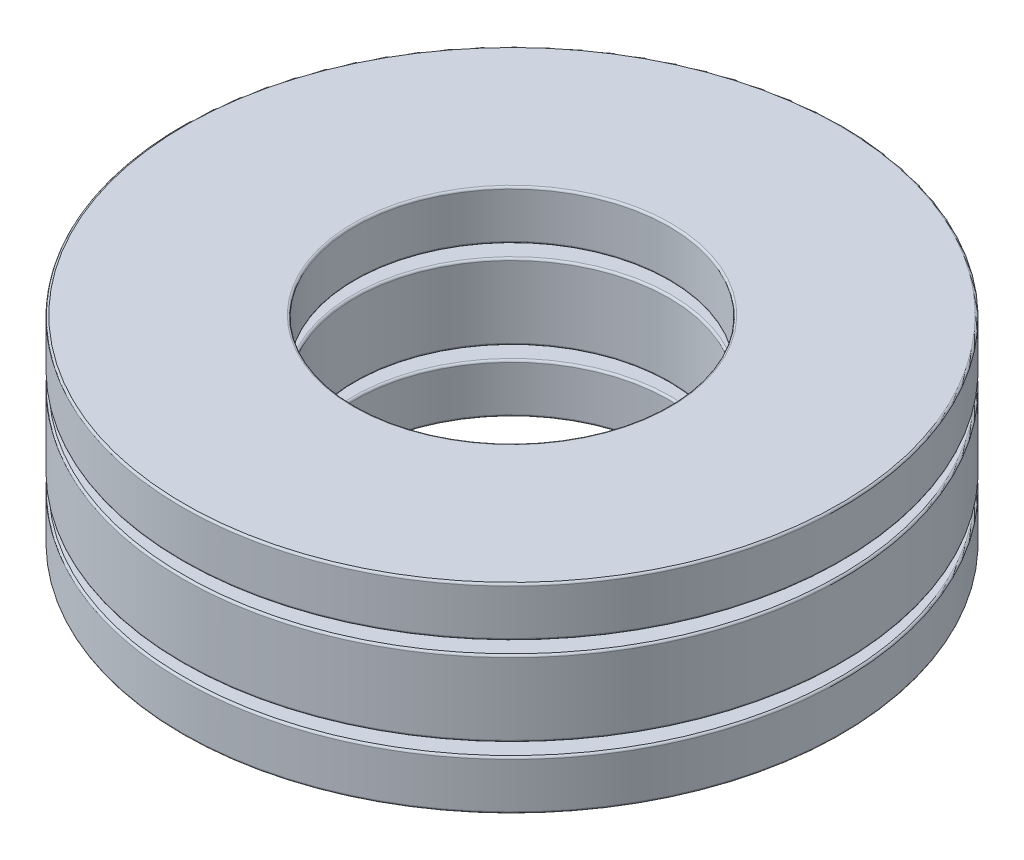
from build123d import *

# Parameters (mm, degrees)
SKETCH3_W         = 5.5
SKETCH3_H         = 2.4075
CIRPATTERN1_COUNT = 6
CIRPATTERN1_ANGLE = 300
CIRPATTERN2_COUNT = 6
SKETCH6_W         = 5.5
SKETCH6_H         = 1.57
FILLET1_R         = 0.0635
FILLET2_R         = 0.0635
FILLET3_R         = 0.0635


with BuildPart() as part:
    # Sketch3 → Revolve1 (revolve)
    with BuildSketch(Plane.XY, mode=Mode.PRIVATE) as revolve1_sk:
        with Locations((7.75, 0)):
            Rectangle(SKETCH3_W, SKETCH3_H)
    revolve(revolve1_sk.sketch.rotate(Axis((0, 3.175, 0), (0, -1, 0)), 90), axis=Axis((0, 3.175, 0), (0, -1, 0)))

    # Sketch4 → Cut-Revolve1 (revolve, cut)
    with BuildSketch(Plane.XY):
        with BuildLine():
            Line((7.55, 1.605), (7.55, -1.605))
            ThreePointArc((7.55, -1.605), (5.945, 0), (7.55, 1.605))
        make_face()
    cut_revolve1 = revolve(axis=Axis((7.55, 1.605, 0), (0, -1, 0)), mode=Mode.SUBTRACT)

    # CirPattern2: Cut-Revolve1 ×6 about axis
    cirpattern2_axis = Axis((0, 0, 0), (0, 1, 0))
    for i in range(1, CIRPATTERN2_COUNT):
        add(cut_revolve1.rotate(cirpattern2_axis, i * 360 / CIRPATTERN2_COUNT), mode=Mode.SUBTRACT)

    # Fillet2
    fillet2_edges = [part.edges().sort_by_distance(p)[0] for p in [
        (8.611607714, 1.20375, 0),
        (8.611607714, -1.20375, 0),
        (4.305803857, 1.20375, 7.457871047),
        (4.305803857, -1.20375, 7.457871047),
        (-4.305803857, 1.20375, 7.457871047),
        (-4.305803857, -1.20375, 7.457871047),
        (-8.611607714, 1.20375, 0),
        (-8.611607714, -1.20375, 0),
        (-4.305803857, 1.20375, -7.457871047),
        (-4.305803857, -1.20375, -7.457871047),
        (4.305803857, 1.20375, -7.457871047),
        (4.305803857, -1.20375, -7.457871047),
        (0, 1.20375, -10.5),
        (0, 1.20375, -5),
        (0, -1.20375, -5),
        (0, -1.20375, -10.5),
    ]]
    fillet(fillet2_edges, radius=FILLET2_R)


with BuildPart() as body_2:
    # Sketch5 → Revolve2 (revolve)
    with BuildSketch(Plane.XY):
        with BuildLine():
            Line((7.55, 1.605), (7.55, -1.605))
            ThreePointArc((7.55, -1.605), (5.945, 0), (7.55, 1.605))
        make_face()
    revolve(axis=Axis((7.55, 1.605, 0), (0, -1, 0)))


with BuildPart() as cirpattern1_1:
    # CirPattern1: pattern copy
    add(body_2.part.rotate(Axis((0, 3.175, 0), (0, -1, 0)), 1 * CIRPATTERN1_ANGLE / (CIRPATTERN1_COUNT - 1)))


with BuildPart() as cirpattern1_2:
    # CirPattern1: pattern copy
    add(body_2.part.rotate(Axis((0, 3.175, 0), (0, -1, 0)), 2 * CIRPATTERN1_ANGLE / (CIRPATTERN1_COUNT - 1)))


with BuildPart() as cirpattern1_3:
    # CirPattern1: pattern copy
    add(body_2.part.rotate(Axis((0, 3.175, 0), (0, -1, 0)), 3 * CIRPATTERN1_ANGLE / (CIRPATTERN1_COUNT - 1)))


with BuildPart() as cirpattern1_4:
    # CirPattern1: pattern copy
    add(body_2.part.rotate(Axis((0, 3.175, 0), (0, -1, 0)), 4 * CIRPATTERN1_ANGLE / (CIRPATTERN1_COUNT - 1)))


with BuildPart() as cirpattern1_5:
    # CirPattern1: pattern copy
    add(body_2.part.rotate(Axis((0, 3.175, 0), (0, -1, 0)), 5 * CIRPATTERN1_ANGLE / (CIRPATTERN1_COUNT - 1)))


with BuildPart() as body_8:
    # Sketch6 → Revolve3 (revolve)
    with BuildSketch(Plane.XY, mode=Mode.PRIVATE) as revolve3_sk:
        with Locations((7.75, 2.39)):
            Rectangle(SKETCH6_W, SKETCH6_H)
        with Locations((7.75, -2.39)):
            Rectangle(SKETCH6_W, SKETCH6_H)
    revolve(revolve3_sk.sketch.rotate(Axis((0, 3.175, 0), (0, -1, 0)), 90), axis=Axis((0, 3.175, 0), (0, -1, 0)))

    # Fillet1
    fillet1_edges = [body_8.edges().sort_by_distance(p)[0] for p in [
        (0, 3.175, -10.5),
        (0, 3.175, -5),
        (0, 1.605, -5),
        (0, 1.605, -10.5),
    ]]
    fillet(fillet1_edges, radius=FILLET1_R)

    # Fillet3
    fillet3_edges = [body_8.edges().sort_by_distance(p)[0] for p in [
        (0, -1.605, -10.5),
        (0, -1.605, -5),
        (0, -3.175, -5),
        (0, -3.175, -10.5),
    ]]
    fillet(fillet3_edges, radius=FILLET3_R)


solid = Compound([part.part, body_2.part, cirpattern1_1.part, cirpattern1_2.part, cirpattern1_3.part, cirpattern1_4.part, cirpattern1_5.part, body_8.part])
